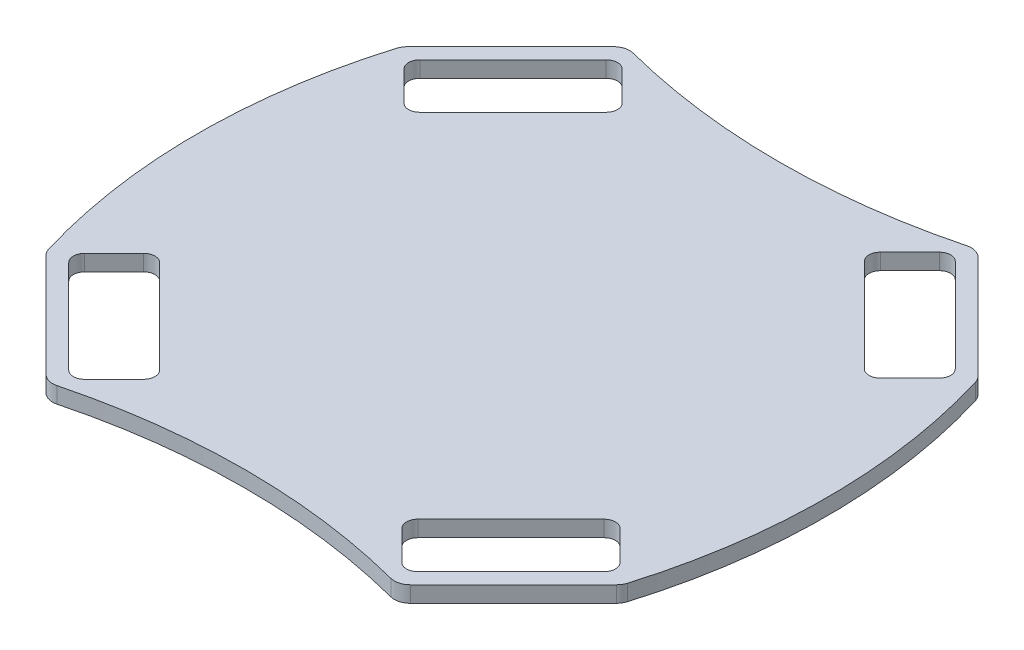
from build123d import *

# Parameters (mm, degrees)
RESSALTO_EXTRUS_O2_DEPTH = 5
CORTE_EXTRUS_O1_DEPTH    = 5


with BuildPart() as part:
    # Esboço1 → Ressalto-extrusão2 (new body)
    with BuildSketch(Plane(origin=(0, 0, 0), x_dir=(1, 0, 0), z_dir=(0, 1, 0))):
        with BuildLine():
            Line((-50.542684331, 81.382727595), (-18.443667531, 113.481744396))
            ThreePointArc((-18.443667531, 113.481744396), (-16.222396505, 114.770390532), (-13.65444113, 114.786484772))
            ThreePointArc((-13.65444113, 114.786484772), (38.248428139, 108.173840066), (90.151297409, 114.786484772))
            ThreePointArc((90.151297409, 114.786484772), (92.719252784, 114.770390532), (94.94052381, 113.481744396))
            Line((94.94052381, 113.481744396), (127.03954061, 81.382727595))
            ThreePointArc((127.03954061, 81.382727595), (127.79593841, 80.412212643), (128.29241049, 79.286356356))
            ThreePointArc((128.29241049, 79.286356356), (136.248428139, 25.173840066), (128.29241049, -28.938676225))
            ThreePointArc((128.29241049, -28.938676225), (127.79593841, -30.064532511), (127.03954061, -31.035047464))
            Line((127.03954061, -31.035047464), (94.94052381, -63.134064264))
            ThreePointArc((94.94052381, -63.134064264), (92.719252784, -64.4227104), (90.151297409, -64.438804641))
            ThreePointArc((90.151297409, -64.438804641), (38.248428139, -57.826159934), (-13.65444113, -64.438804641))
            ThreePointArc((-13.65444113, -64.438804641), (-16.222396505, -64.4227104), (-18.443667531, -63.134064264))
            Line((-18.443667531, -63.134064264), (-50.542684331, -31.035047464))
            ThreePointArc((-50.542684331, -31.035047464), (-51.299082131, -30.064532511), (-51.795554211, -28.938676225))
            ThreePointArc((-51.795554211, -28.938676225), (-59.751571861, 25.173840066), (-51.795554211, 79.286356356))
            ThreePointArc((-51.795554211, 79.286356356), (-51.299082131, 80.412212643), (-50.542684331, 81.382727595))
        make_face()
    extrude(amount=RESSALTO_EXTRUS_O2_DEPTH)

    # Esboço2 → Corte-extrusão1 (cut)
    with BuildSketch(Plane(origin=(0, 5, 0), x_dir=(1, 0, 0), z_dir=(0, 1, 0))):
        with BuildLine():
            Line((-30.957642025, 93.896702089), (-45.049304874, 79.805039241))
            ThreePointArc((-45.049304874, 79.805039241), (-46.07443114, 77.330165506), (-45.049304874, 74.855291772))
            Line((-45.049304874, 74.855291772), (-35.856916719, 65.662903617))
            ThreePointArc((-35.856916719, 65.662903617), (-33.382042984, 64.637777351), (-30.90716925, 65.662903617))
            Line((-30.90716925, 65.662903617), (-1.915791222, 94.654281645))
            ThreePointArc((-1.915791222, 94.654281645), (-0.890664956, 97.12915538), (-1.915791222, 99.604029114))
            Line((-1.915791222, 99.604029114), (-11.108179377, 108.796417269))
            ThreePointArc((-11.108179377, 108.796417269), (-13.583053111, 109.821543535), (-16.057926845, 108.796417269))
            Line((-16.057926845, 108.796417269), (-30.957642025, 93.896702089))
        make_face()
        with BuildLine():
            Line((-30.957642025, -43.549021958), (-16.057926845, -58.448737138))
            ThreePointArc((-16.057926845, -58.448737138), (-13.583053111, -59.473863403), (-11.108179377, -58.448737138))
            Line((-11.108179377, -58.448737138), (-1.915791222, -49.256348982))
            ThreePointArc((-1.915791222, -49.256348982), (-0.890664956, -46.781475248), (-1.915791222, -44.306601514))
            Line((-1.915791222, -44.306601514), (-30.90716925, -15.315223485))
            ThreePointArc((-30.90716925, -15.315223485), (-33.382042984, -14.290097219), (-35.856916719, -15.315223485))
            Line((-35.856916719, -15.315223485), (-45.049304874, -24.507611641))
            ThreePointArc((-45.049304874, -24.507611641), (-46.07443114, -26.982485375), (-45.049304874, -29.457359109))
            Line((-45.049304874, -29.457359109), (-30.957642025, -43.549021958))
        make_face()
        with BuildLine():
            Line((107.454498304, -43.549021958), (121.546161153, -29.457359109))
            ThreePointArc((121.546161153, -29.457359109), (122.571287419, -26.982485375), (121.546161153, -24.507611641))
            Line((121.546161153, -24.507611641), (112.353772997, -15.315223485))
            ThreePointArc((112.353772997, -15.315223485), (109.878899263, -14.290097219), (107.404025529, -15.315223485))
            Line((107.404025529, -15.315223485), (78.4126475, -44.306601514))
            ThreePointArc((78.4126475, -44.306601514), (77.387521235, -46.781475248), (78.4126475, -49.256348982))
            Line((78.4126475, -49.256348982), (87.605035656, -58.448737138))
            ThreePointArc((87.605035656, -58.448737138), (90.07990939, -59.473863403), (92.554783124, -58.448737138))
            Line((92.554783124, -58.448737138), (107.454498304, -43.549021958))
        make_face()
        with BuildLine():
            Line((87.605035656, 108.796417269), (78.4126475, 99.604029114))
            ThreePointArc((78.4126475, 99.604029114), (77.387521235, 97.12915538), (78.4126475, 94.654281645))
            Line((78.4126475, 94.654281645), (107.404025529, 65.662903617))
            ThreePointArc((107.404025529, 65.662903617), (109.878899263, 64.637777351), (112.353772997, 65.662903617))
            Line((112.353772997, 65.662903617), (121.546161153, 74.855291772))
            ThreePointArc((121.546161153, 74.855291772), (122.571287419, 77.330165506), (121.546161153, 79.805039241))
            Line((121.546161153, 79.805039241), (107.454498304, 93.896702089))
            Line((107.454498304, 93.896702089), (92.554783124, 108.796417269))
            ThreePointArc((92.554783124, 108.796417269), (90.07990939, 109.821543535), (87.605035656, 108.796417269))
        make_face()
    extrude(amount=-CORTE_EXTRUS_O1_DEPTH, mode=Mode.SUBTRACT)


solid = part.part
